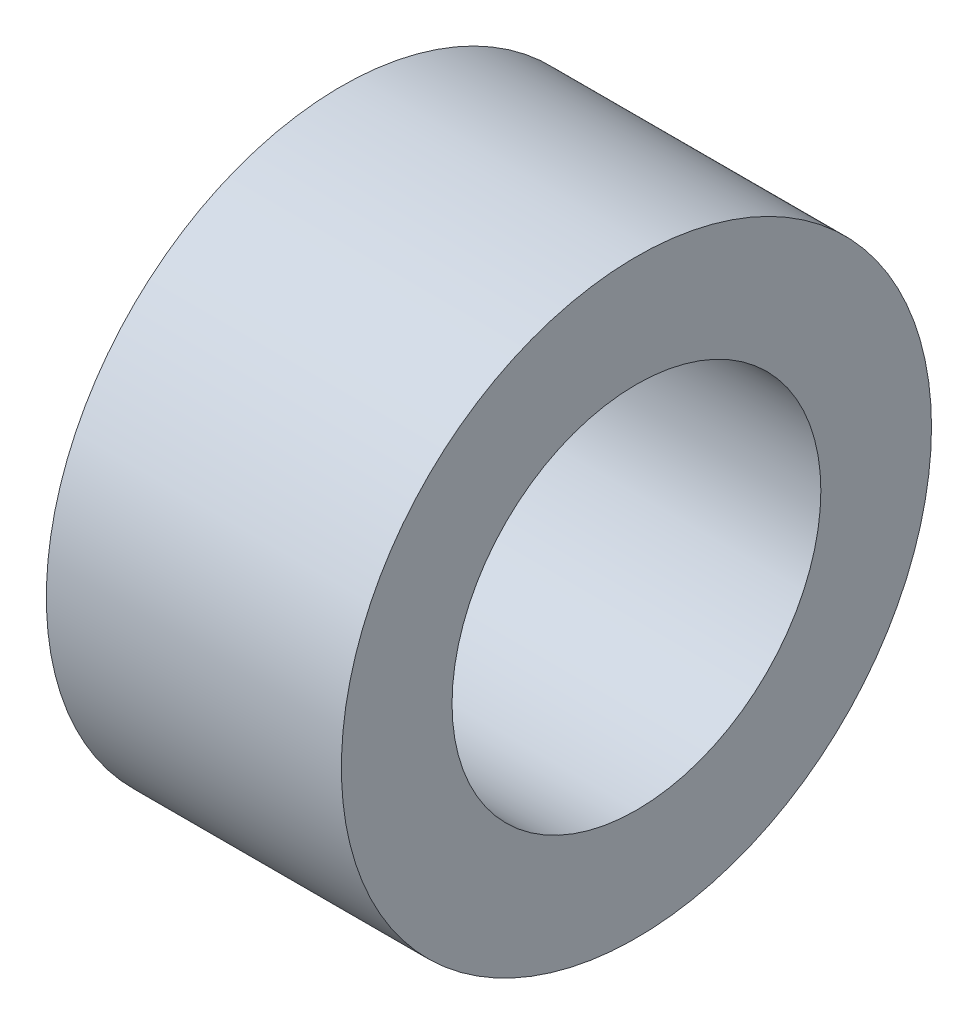
from build123d import *

# Parameters (mm, degrees)
SKETCH1_R           = 5
SKETCH1_R_2         = 3.125
BOSS_EXTRUDE1_DEPTH = 2.5


with BuildPart() as part:
    # Sketch1 → Boss-Extrude1 (new, symmetric)
    with BuildSketch(Plane(origin=(0, 0, 0), x_dir=(0, 0, -1), z_dir=(1, 0, 0))):
        Circle(SKETCH1_R)
        Circle(SKETCH1_R_2, mode=Mode.SUBTRACT)
    extrude(amount=BOSS_EXTRUDE1_DEPTH, both=True)


solid = part.part
